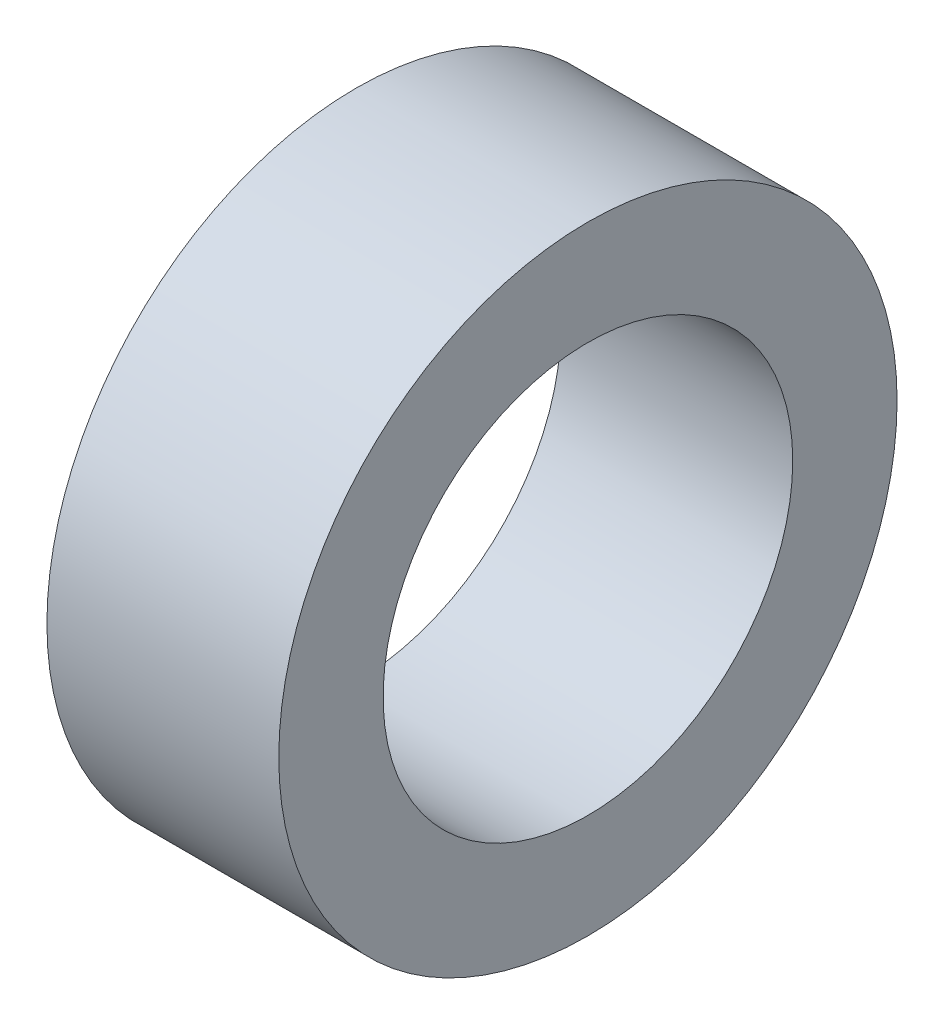
from build123d import *

# Parameters (mm, degrees)
SKETCH1_R           = 4
SKETCH1_R_2         = 2.65
BOSS_EXTRUDE1_DEPTH = 3


with BuildPart() as part:
    # Sketch1 → Boss-Extrude1 (new body)
    with BuildSketch(Plane(origin=(0, 0, 0), x_dir=(0, 0, -1), z_dir=(1, 0, 0))):
        Circle(SKETCH1_R)
        Circle(SKETCH1_R_2, mode=Mode.SUBTRACT)
    extrude(amount=BOSS_EXTRUDE1_DEPTH)


solid = part.part
